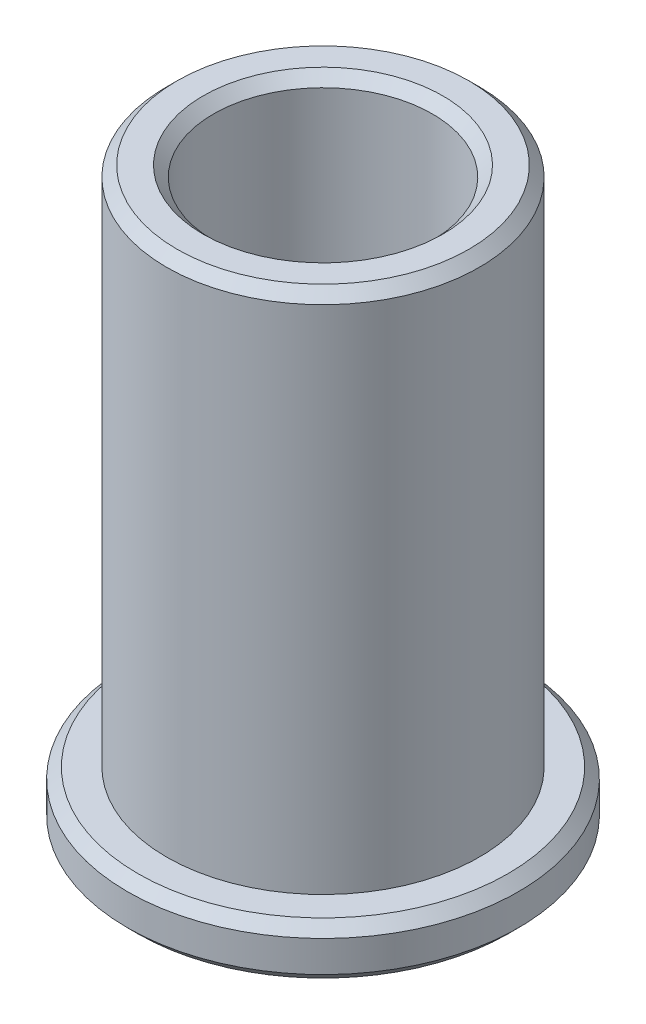
from build123d import *

# Parameters (mm, degrees)
SKETCH_1_R          = 3.75
EXTRUDE_1_DEPTH     = 1
SKETCH_2_R          = 3
EXTRUDE_2_DEPTH     = 10
SKETCH_3_R          = 2.1
CUT_EXTRUDE_1_DEPTH = 13.211674742
CHAMFER_1_SIZE      = 0.2
CHAMFER_2_SIZE      = 0.2


with BuildPart() as part:
    # 草图1 → 凸台-拉伸1 (new body)
    with BuildSketch(Plane(origin=(0, 0, 0), x_dir=(1, 0, 0), z_dir=(0, 1, 0))):
        with Locations(Location((0, 0, 0), (0, 0, 270))):
            Circle(SKETCH_1_R)
    extrude(amount=EXTRUDE_1_DEPTH)

    # 草图2 → 凸台-拉伸2 (add)
    with BuildSketch(Plane(origin=(0, 1, 0), x_dir=(1, 0, 0), z_dir=(0, 1, 0))):
        with Locations(Location((0, 0, 0), (0, 0, 270))):
            Circle(SKETCH_2_R)
    extrude(amount=EXTRUDE_2_DEPTH)

    # 草图3 → 切除-拉伸1 (cut, through all)
    with BuildSketch(Plane(origin=(0, 11, 0), x_dir=(1, 0, 0), z_dir=(0, 1, 0))):
        with Locations(Location((0, 0, 0), (0, 0, 270))):
            Circle(SKETCH_3_R)
    extrude(amount=-CUT_EXTRUDE_1_DEPTH, mode=Mode.SUBTRACT)

    # 倒角1
    chamfer_1_edges = [part.edges().sort_by_distance(p)[0] for p in [
        (0, 1, -3.75),
        (0, 11, -3),
    ]]
    chamfer(chamfer_1_edges, length=CHAMFER_1_SIZE)

    # 倒角2
    chamfer_2_edges = [part.edges().sort_by_distance(p)[0] for p in [
        (0, 0, -2.1),
        (0, 11, -2.1),
        (0, 0, -3.75),
    ]]
    chamfer(chamfer_2_edges, length=CHAMFER_2_SIZE)


solid = part.part
